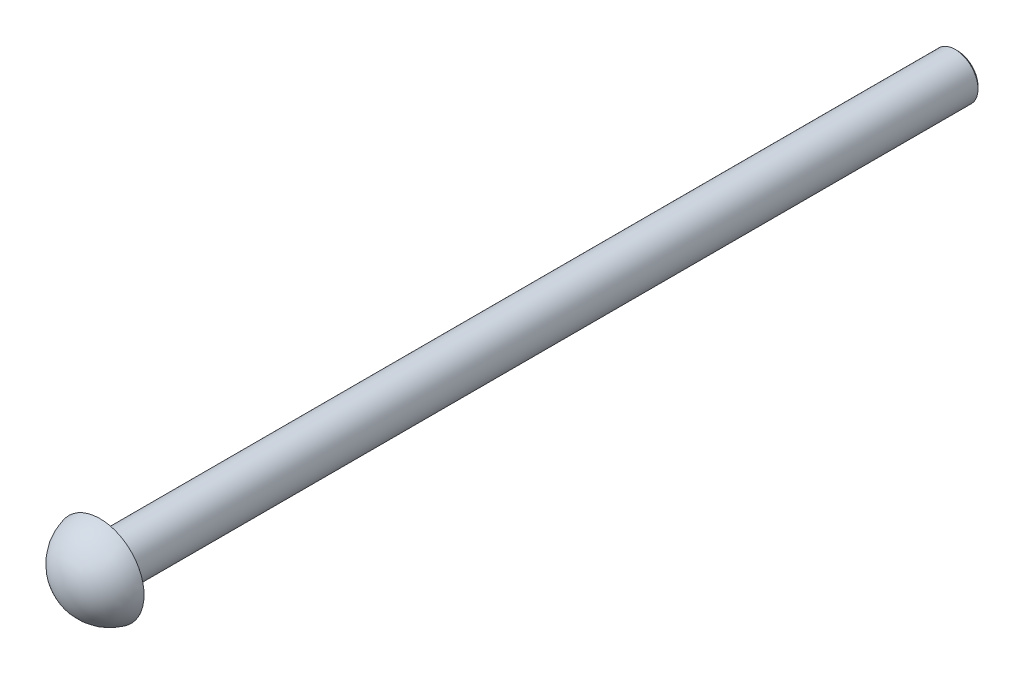
from build123d import *

# Parameters (mm, degrees)
SKETCH1_R           = 1.9325
BOSS_EXTRUDE1_DEPTH = 112.316
SKETCH2_R           = 3.730040454
BOSS_EXTRUDE2_DEPTH = 0.001
DOME1_FACE_RADIUS   = 3.730040454
DOME1_HEIGHT        = 3
SCALE1_SCALE        = 1.5
SKETCH3_R           = 2.89875
CUT_EXTRUDE1_DEPTH  = 59.7
CHAMFER1_SIZE       = 0.3


with BuildPart() as part:
    # Sketch1 → Boss-Extrude1 (new body)
    with BuildSketch(Plane.XY):
        with Locations(Location((0, 0, 0), (0, 0, 180))):
            Circle(SKETCH1_R)
    extrude(amount=BOSS_EXTRUDE1_DEPTH)

    # Sketch2 → Boss-Extrude2 (add)
    with BuildSketch(Plane.XY.offset(112.316)):
        Circle(SKETCH2_R)
    extrude(amount=BOSS_EXTRUDE2_DEPTH)

    # Dome1: a dome of height H over a round flat face of radius A is a cap of a sphere of radius (A * A + H * H) / (2 * H)
    dome1_r = (DOME1_FACE_RADIUS * DOME1_FACE_RADIUS + DOME1_HEIGHT * DOME1_HEIGHT) / (2 * DOME1_HEIGHT)
    dome1_base = Plane((0, 0, 112.317), z_dir=(0, 0, 1))
    with Locations(dome1_base.offset(DOME1_HEIGHT - dome1_r)):
        dome1_ball = Sphere(dome1_r, mode=Mode.PRIVATE)
    add(split(dome1_ball, bisect_by=dome1_base, keep=Keep.TOP, mode=Mode.PRIVATE))


with BuildPart() as part_1:
    # Scale1: scaled about (0, 0, 59.424709499)
    add(part.part.scale(SCALE1_SCALE).moved(Location((0, 0, -29.71235475))))

    # Sketch3 → Cut-Extrude1 (cut)
    with BuildSketch(Plane(origin=(0, 0, -29.712354749), x_dir=(-1, 0, 0), z_dir=(0, 0, -1))):
        Circle(SKETCH3_R)
    extrude(amount=-CUT_EXTRUDE1_DEPTH, mode=Mode.SUBTRACT)

    # Chamfer1
    chamfer1_edges = [part_1.edges().sort_by_distance(p)[0] for p in [
        (2.89875, 0, 29.987645251),
    ]]
    chamfer(chamfer1_edges, length=CHAMFER1_SIZE)


solid = part_1.part
